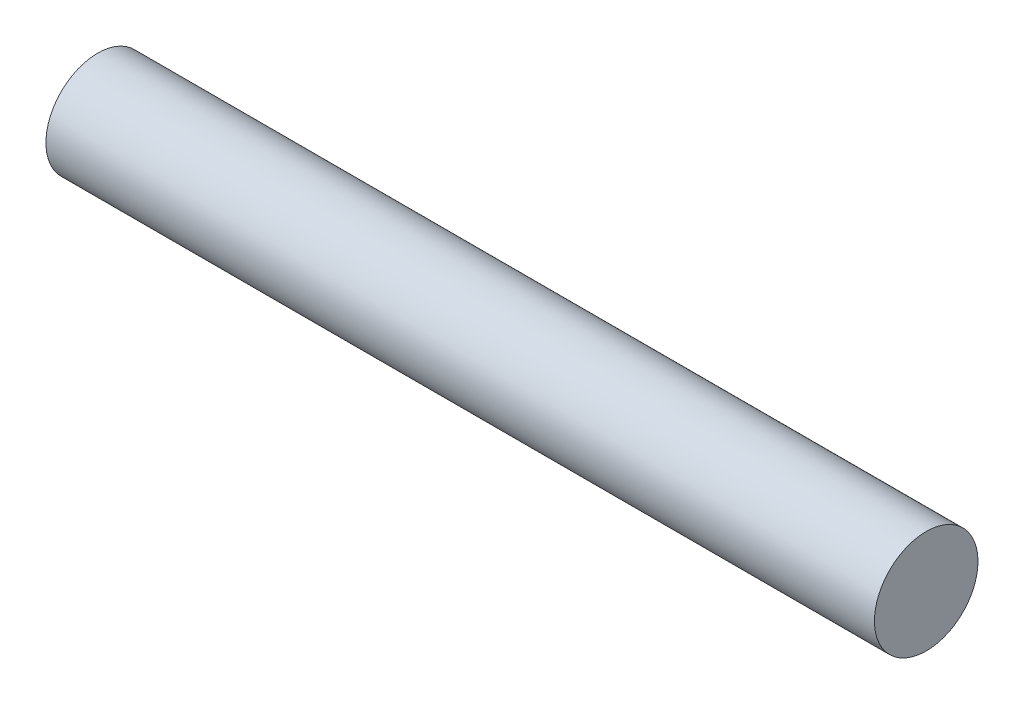
from build123d import *

# Parameters (mm, degrees)
SKETCH1_R           = 2.5
BOSS_EXTRUDE1_DEPTH = 40


with BuildPart() as part:
    # Sketch1 → Boss-Extrude1 (new body)
    with BuildSketch(Plane(origin=(0, 0, 0), x_dir=(0, 0, -1), z_dir=(1, 0, 0))):
        Circle(SKETCH1_R)
    extrude(amount=BOSS_EXTRUDE1_DEPTH)


solid = part.part
